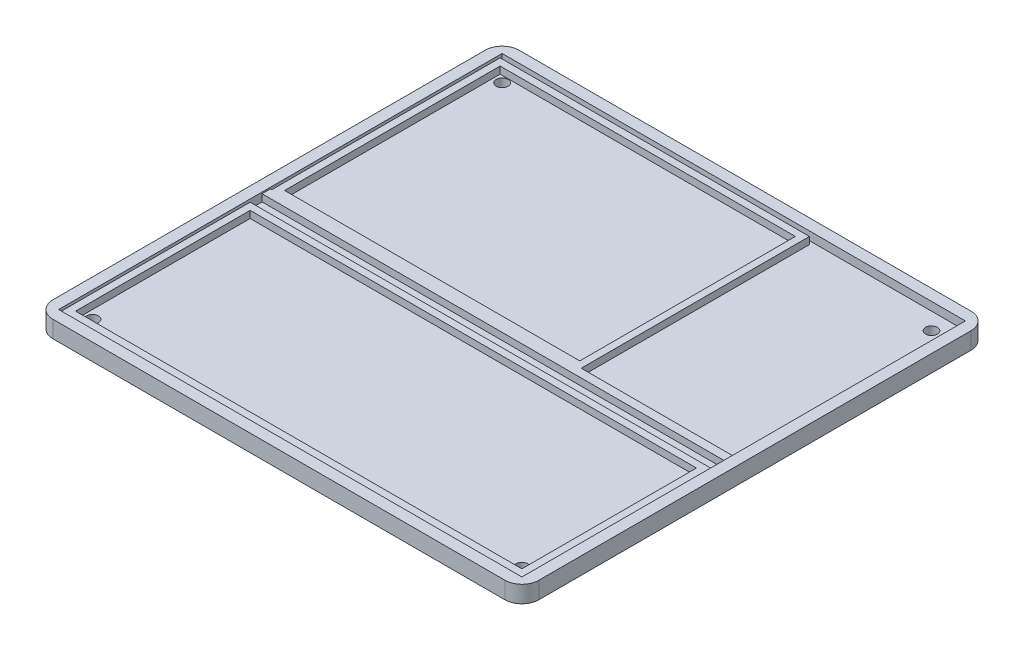
from build123d import *

# Parameters (mm, degrees)
TRAY_BODY_DEPTH              = 6
SK_POCKET_W                  = 164
SK_POCKET_H                  = 157
TRAY_POCKET_DEPTH            = 239.365265926
SK_ESP32GUIDE_W              = 163
SK_ESP32GUIDE_H              = 66.8
SK_ESP32GUIDE_W_2            = 158
SK_ESP32GUIDE_H_2            = 61.8
ESP32_HOUSING_GUIDE_DEPTH    = 2.5
SK_PI5GUIDE_W                = 109.5
SK_PI5GUIDE_H                = 81.3
SK_PI5GUIDE_W_2              = 104.5
SK_PI5GUIDE_H_2              = 76.3
PI5_CAGE_GUIDE_DEPTH         = 2.5
SK_DIVIDER_W                 = 164
SK_DIVIDER_H                 = 3
CENTER_DIVIDER_DEPTH         = 2.5
M4_MOUNTING_HOLES_DEPTH      = 239.421894968
M4_MOUNTING_HOLES_DEPTH_BACK = 239.421894968
SK_MOUNTHOLES_R              = 2.1


with BuildPart() as part:
    # Sk_Outline → Tray Body (new body)
    with BuildSketch(Plane(origin=(0, 0, 0), x_dir=(1, 0, 0), z_dir=(0, 1, 0))):
        with BuildLine():
            Line((6, 0), (166, 0))
            ThreePointArc((166, 0), (170.242640687, 1.757359313), (172, 6))
            Line((172, 6), (172, 159))
            ThreePointArc((172, 159), (170.242640687, 163.242640687), (166, 165))
            Line((166, 165), (6, 165))
            ThreePointArc((6, 165), (1.757359313, 163.242640687), (0, 159))
            Line((0, 159), (0, 6))
            ThreePointArc((0, 6), (1.757359313, 1.757359313), (6, 0))
        make_face()
    extrude(amount=TRAY_BODY_DEPTH)

    # Sk_Pocket → Tray Pocket (cut, through all)
    with BuildSketch(Plane(origin=(0, 3, 0), x_dir=(1, 0, 0), z_dir=(0, 1, 0))):
        with Locations((86, 82.5)):
            Rectangle(SK_POCKET_W, SK_POCKET_H)
    extrude(amount=TRAY_POCKET_DEPTH, mode=Mode.SUBTRACT)

    # Sk_ESP32Guide → ESP32 Housing Guide (add)
    with BuildSketch(Plane(origin=(0, 3, 0), x_dir=(1, 0, 0), z_dir=(0, 1, 0))):
        with Locations((86, 37.9)):
            Rectangle(SK_ESP32GUIDE_W, SK_ESP32GUIDE_H)
        with Locations((86, 37.9)):
            Rectangle(SK_ESP32GUIDE_W_2, SK_ESP32GUIDE_H_2, mode=Mode.SUBTRACT)
    extrude(amount=ESP32_HOUSING_GUIDE_DEPTH)

    # Sk_Pi5Guide → Pi5 Cage Guide (add)
    with BuildSketch(Plane(origin=(0, 3, 0), x_dir=(1, 0, 0), z_dir=(0, 1, 0))):
        with Locations((59.25, 119.15)):
            Rectangle(SK_PI5GUIDE_W, SK_PI5GUIDE_H)
        with Locations((59.25, 119.15)):
            Rectangle(SK_PI5GUIDE_W_2, SK_PI5GUIDE_H_2, mode=Mode.SUBTRACT)
    extrude(amount=PI5_CAGE_GUIDE_DEPTH)

    # Sk_Divider → Center Divider (add)
    with BuildSketch(Plane(origin=(0, 3, 0), x_dir=(1, 0, 0), z_dir=(0, 1, 0))):
        with Locations((86, 77.5)):
            Rectangle(SK_DIVIDER_W, SK_DIVIDER_H)
    extrude(amount=CENTER_DIVIDER_DEPTH)

    # Sk_MountHoles → M4 Mounting Holes (cut, two sides: drawn at the far end of the back side and taken through both)
    with BuildSketch(Plane(origin=(0, 0, 0), x_dir=(1, 0, 0), z_dir=(0, 1, 0)).offset(-M4_MOUNTING_HOLES_DEPTH_BACK)):
        with Locations(Location((10, 10, 0), (0, 0, 270))):
            Circle(SK_MOUNTHOLES_R)
        with Locations(Location((10, 155, 0), (0, 0, 270))):
            Circle(SK_MOUNTHOLES_R)
        with Locations(Location((162, 10, 0), (0, 0, 270))):
            Circle(SK_MOUNTHOLES_R)
        with Locations(Location((162, 155, 0), (0, 0, 270))):
            Circle(SK_MOUNTHOLES_R)
    extrude(amount=M4_MOUNTING_HOLES_DEPTH + M4_MOUNTING_HOLES_DEPTH_BACK, mode=Mode.SUBTRACT)


solid = part.part
